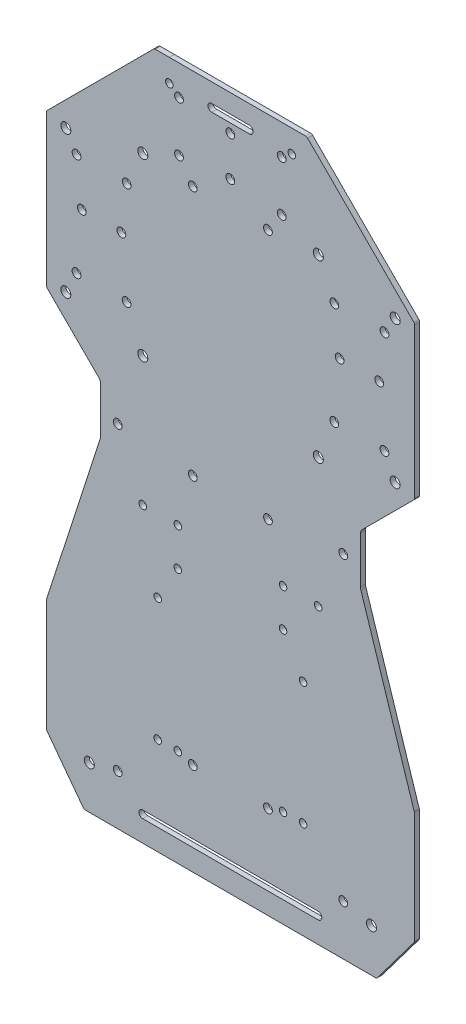
from build123d import *

# Parameters (mm, degrees)
MODEL_R             = 1.5
MODEL_R_2           = 2
EXTRUDE_1_DEPTH     = 2
SKETCH_1_R          = 1.5
CUT_EXTRUDE_1_DEPTH = 2
SKETCH_2_R          = 1.75
CUT_EXTRUDE_2_DEPTH = 10
SKETCH_3_R          = 1.75
CUT_EXTRUDE_3_DEPTH = 10
SKETCH_4_R          = 1.75
CUT_EXTRUDE_4_DEPTH = 10


with BuildPart() as part:
    # Model → 凸台-拉伸1 (new body)
    with BuildSketch(Plane.XY):
        with BuildLine():
            Line((2310.044763103, 1913.686306773), (2310.061692874, 1973.704377759))
            ThreePointArc((2310.061692874, 1973.704377759), (2310.137921285, 1974.087039704), (2310.35478554, 1974.411401894))
            Line((2310.35478554, 1974.411401894), (2352.80617543, 2016.838849342))
            ThreePointArc((2352.80617543, 2016.838849342), (2353.130529599, 2017.055476626), (2353.513082724, 2017.131543129))
            Line((2353.513082724, 2017.131543129), (2359.09903439, 2017.131543129))
            Line((2359.09903439, 2017.131543129), (2413.531484169, 2017.114496472))
            ThreePointArc((2413.531484169, 2017.114496472), (2413.914146114, 2017.038268061), (2414.238508304, 2016.821403806))
            Line((2414.238508304, 2016.821403806), (2456.665838951, 1974.370130782))
            ThreePointArc((2456.665838951, 1974.370130782), (2456.882520181, 1974.045646299), (2456.958532699, 1973.66294141))
            Line((2456.958532699, 1973.66294141), (2456.941602882, 1913.644705177))
            ThreePointArc((2456.941602882, 1913.644705177), (2456.865374471, 1913.262043231), (2456.648510216, 1912.937681042))
            Line((2456.648510216, 1912.937681042), (2435.982160618, 1892.282987197))
            ThreePointArc((2435.982160618, 1892.282987197), (2435.548531394, 1891.634502283), (2435.395975499, 1890.86945739))
            Line((2435.395975499, 1890.86945739), (2435.385853308, 1872.169989535))
            ThreePointArc((2435.385853308, 1872.169989535), (2435.422265409, 1871.702372721), (2435.531117903, 1871.246146395))
            Line((2435.531117903, 1871.246146395), (2456.832006312, 1805.309121837))
            ThreePointArc((2456.832006312, 1805.309121837), (2456.868292251, 1805.15703511), (2456.880427831, 1805.001151277))
            Line((2456.880427831, 1805.001151277), (2456.855314427, 1760.486136893))
            ThreePointArc((2456.855314427, 1760.486136893), (2456.80382295, 1760.169948963), (2456.654989684, 1759.886268089))
            Line((2456.654989684, 1759.886268089), (2442.15029156, 1740.568464651))
            ThreePointArc((2442.15029156, 1740.568464651), (2441.797466901, 1740.274288933), (2441.350345809, 1740.168897647))
            Line((2441.350345809, 1740.168897647), (2325.54447705, 1740.200241027))
            ThreePointArc((2325.54447705, 1740.200241027), (2325.097413073, 1740.305874328), (2324.744747705, 1740.600240991))
            Line((2324.744747705, 1740.600240991), (2310.244646216, 1759.933709642))
            ThreePointArc((2310.244646216, 1759.933709642), (2310.095962918, 1760.217481876), (2310.044646216, 1760.533709642))
            Line((2310.044646216, 1760.533709642), (2310.044646216, 1805.042570403))
            ThreePointArc((2310.044646216, 1805.042570403), (2310.056869737, 1805.198447365), (2310.093241471, 1805.350513596))
            Line((2310.093241471, 1805.350513596), (2331.434636288, 1871.285740281))
            ThreePointArc((2331.434636288, 1871.285740281), (2331.543751489, 1871.741938976), (2331.580422052, 1872.209569862))
            Line((2331.580422052, 1872.209569862), (2331.580422052, 1890.907725019))
            ThreePointArc((2331.580422052, 1890.907725019), (2331.428181117, 1891.673091884), (2330.994635614, 1892.321938582))
            Line((2330.994635614, 1892.321938582), (2310.337656282, 1912.978917914))
            ThreePointArc((2310.337656282, 1912.978917914), (2310.120829567, 1913.303471569), (2310.044763103, 1913.686306773))
        make_face()
        with Locations((2359.09903439, 2008.131543129)):
            Circle(MODEL_R, mode=Mode.SUBTRACT)
        with Locations((2407.945697715, 2008.131543129)):
            Circle(MODEL_R, mode=Mode.SUBTRACT)
        with Locations((2348.501647878, 1978.674541468)):
            Circle(MODEL_R_2, mode=Mode.SUBTRACT)
        with Locations((2348.501647878, 1908.674541468)):
            Circle(MODEL_R_2, mode=Mode.SUBTRACT)
        with Locations((2418.543084227, 1978.674541468)):
            Circle(MODEL_R_2, mode=Mode.SUBTRACT)
        with Locations((2418.543084227, 1908.674541468)):
            Circle(MODEL_R_2, mode=Mode.SUBTRACT)
        with Locations((2412.471188929, 1828.036421631)):
            Circle(MODEL_R, mode=Mode.SUBTRACT)
        with Locations((2317.78863196, 1972.045859296)):
            Circle(MODEL_R_2, mode=Mode.SUBTRACT)
        with Locations((2449.230659179, 1972.008782408)):
            Circle(MODEL_R_2, mode=Mode.SUBTRACT)
        with Locations((2354.471188929, 1828.036421631)):
            Circle(MODEL_R, mode=Mode.SUBTRACT)
        with Locations((2354.471188929, 1779.036421631)):
            Circle(MODEL_R, mode=Mode.SUBTRACT)
        with Locations((2412.471188929, 1779.036421631)):
            Circle(MODEL_R, mode=Mode.SUBTRACT)
        with Locations((2327.144646216, 1757.400376309)):
            Circle(MODEL_R_2, mode=Mode.SUBTRACT)
        with Locations((2439.750176643, 1757.400376309)):
            Circle(MODEL_R_2, mode=Mode.SUBTRACT)
        with Locations((2317.772636576, 1915.340300528)):
            Circle(MODEL_R_2, mode=Mode.SUBTRACT)
        with Locations((2449.207368346, 1915.286332047)):
            Circle(MODEL_R_2, mode=Mode.SUBTRACT)
        with Locations((2348.478614662, 1857.106083087)):
            Circle(MODEL_R, mode=Mode.SUBTRACT)
        with Locations((2418.478612099, 1857.087137272)):
            Circle(MODEL_R, mode=Mode.SUBTRACT)
        with Locations((2362.47861415, 1857.102293924)):
            Circle(MODEL_R, mode=Mode.SUBTRACT)
        with Locations((2404.478612663, 1857.091119611)):
            Circle(MODEL_R, mode=Mode.SUBTRACT)
        with BuildLine():
            Line((2376.022366052, 2009.631543129), (2391.022366052, 2009.631543129))
            ThreePointArc((2391.022366052, 2009.631543129), (2392.522366052, 2008.131543129), (2391.022366052, 2006.631543129))
            Line((2391.022366052, 2006.631543129), (2376.022366052, 2006.631543129))
            ThreePointArc((2376.022366052, 2006.631543129), (2374.522366052, 2008.131543129), (2376.022366052, 2009.631543129))
        make_face(mode=Mode.SUBTRACT)
        with BuildLine():
            Line((2348.450119256, 1751.694041878), (2418.450116692, 1751.675096064))
            ThreePointArc((2418.450116692, 1751.675096064), (2419.949710601, 1750.174690192), (2418.450116692, 1748.675096064))
            Line((2418.450116692, 1748.675096064), (2348.450119256, 1748.694041878))
            ThreePointArc((2348.450119256, 1748.694041878), (2346.950525348, 1750.19444775), (2348.450119256, 1751.694041878))
        make_face(mode=Mode.SUBTRACT)
    extrude(amount=EXTRUDE_1_DEPTH)

    # 草图1 → 切除-拉伸1 (cut)
    with BuildSketch(Plane(origin=(0, 0, 0), x_dir=(-1, 0, 0), z_dir=(0, 0, -1))):
        with Locations((-2404.471188929, 1842.036421631)):
            Circle(SKETCH_1_R)
        with Locations((-2362.471188929, 1842.036421631)):
            Circle(SKETCH_1_R)
        with Locations((-2362.471188929, 1779.036421631)):
            Circle(SKETCH_1_R)
        with Locations((-2404.471188929, 1779.036421631)):
            Circle(SKETCH_1_R)
    extrude(amount=-CUT_EXTRUDE_1_DEPTH, mode=Mode.SUBTRACT)

    # 草图2 → 切除-拉伸2 (cut)
    with BuildSketch(Plane(origin=(0, 0, 0), x_dir=(-1, 0, 0), z_dir=(0, 0, -1))):
        with Locations((-2428.510112786, 1880.172373647)):
            Circle(SKETCH_2_R)
        with Locations((-2338.510112786, 1880.172373647)):
            Circle(SKETCH_2_R)
        with Locations((-2428.510112786, 1760.172373647)):
            Circle(SKETCH_2_R)
        with Locations((-2338.510112786, 1760.172373647)):
            Circle(SKETCH_2_R)
    extrude(amount=-CUT_EXTRUDE_2_DEPTH, mode=Mode.SUBTRACT)

    # 草图3 → 切除-拉伸3 (cut)
    with BuildSketch(Plane(origin=(0, 0, 0), x_dir=(-1, 0, 0), z_dir=(0, 0, -1))):
        with Locations((-2444.956091075, 1965.008782408)):
            Circle(SKETCH_3_R)
        with Locations((-2424.956091075, 1965.008782408)):
            Circle(SKETCH_3_R)
        with Locations((-2444.944525882, 1924.008782408)):
            Circle(SKETCH_3_R)
        with Locations((-2424.944525882, 1924.008782408)):
            Circle(SKETCH_3_R)
        with Locations((-2403.950117974, 2005.117496488)):
            Circle(SKETCH_3_R)
        with Locations((-2362.950119985, 2005.130336493)):
            Circle(SKETCH_3_R)
        with Locations((-2403.950117974, 1985.117496488)):
            Circle(SKETCH_3_R)
        with Locations((-2362.950119985, 1985.130336493)):
            Circle(SKETCH_3_R)
        with Locations((-2342.059240516, 1965.008782408)):
            Circle(SKETCH_3_R)
        with Locations((-2322.059240516, 1965.008782408)):
            Circle(SKETCH_3_R)
        with Locations((-2342.047675323, 1924.008784039)):
            Circle(SKETCH_3_R)
        with Locations((-2322.047675323, 1924.008784039)):
            Circle(SKETCH_3_R)
        with Locations((-2442.856091075, 1947.008782408)):
            Circle(SKETCH_3_R)
        with Locations((-2427.056091075, 1947.008782408)):
            Circle(SKETCH_3_R)
        with Locations((-2339.959240516, 1947.008782408)):
            Circle(SKETCH_3_R)
        with Locations((-2324.159240516, 1947.008782408)):
            Circle(SKETCH_3_R)
        with Locations((-2383.450117974, 2003.017496488)):
            Circle(SKETCH_3_R)
        with Locations((-2383.450117974, 1987.217496488)):
            Circle(SKETCH_3_R)
    extrude(amount=-CUT_EXTRUDE_3_DEPTH, mode=Mode.SUBTRACT)

    # 草图4 → 切除-拉伸4 (cut)
    with BuildSketch(Plane(origin=(0, 0, 0), x_dir=(-1, 0, 0), z_dir=(0, 0, -1))):
        with Locations((-2398.450117974, 1977.180510087)):
            Circle(SKETCH_4_R)
        with Locations((-2398.450117974, 1877.180510087)):
            Circle(SKETCH_4_R)
        with Locations((-2398.450117974, 1777.180510087)):
            Circle(SKETCH_4_R)
        with Locations((-2368.450117974, 1977.188629722)):
            Circle(SKETCH_4_R)
        with Locations((-2368.450117974, 1877.188629722)):
            Circle(SKETCH_4_R)
        with Locations((-2368.450117974, 1777.188629722)):
            Circle(SKETCH_4_R)
    extrude(amount=-CUT_EXTRUDE_4_DEPTH, mode=Mode.SUBTRACT)


solid = part.part
